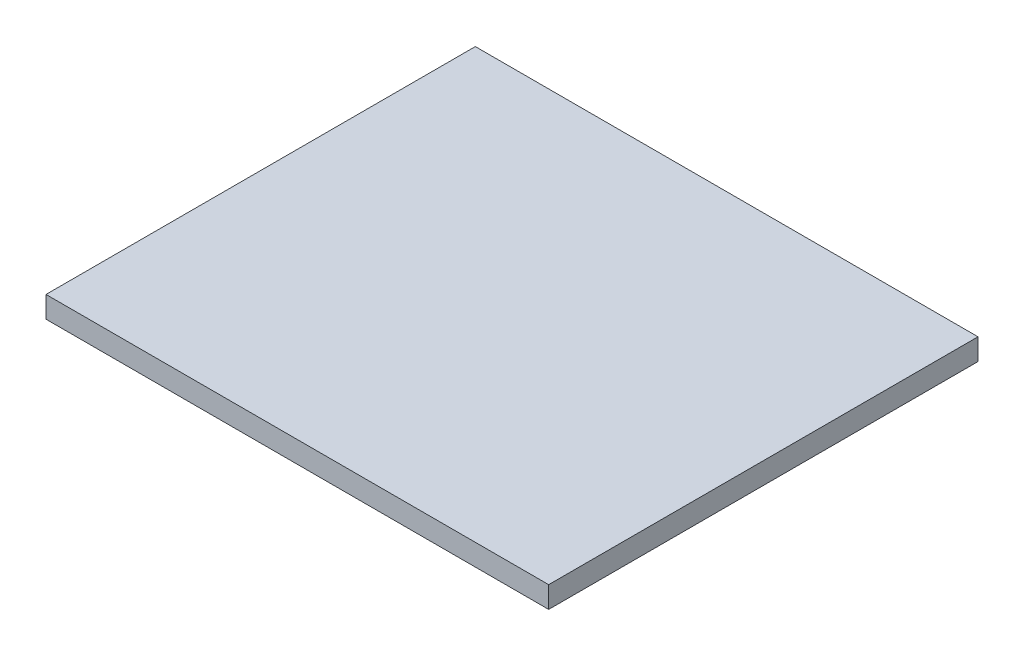
from build123d import *

# Parameters (mm, degrees)
SKETCH1_W           = 281
SKETCH1_H           = 240
BOSS_EXTRUDE1_DEPTH = 12


with BuildPart() as part:
    # Sketch1 → Boss-Extrude1 (new body)
    with BuildSketch(Plane(origin=(0, 0, 0), x_dir=(1, 0, 0), z_dir=(0, 1, 0))):
        Rectangle(SKETCH1_W, SKETCH1_H)
    extrude(amount=BOSS_EXTRUDE1_DEPTH)


solid = part.part
